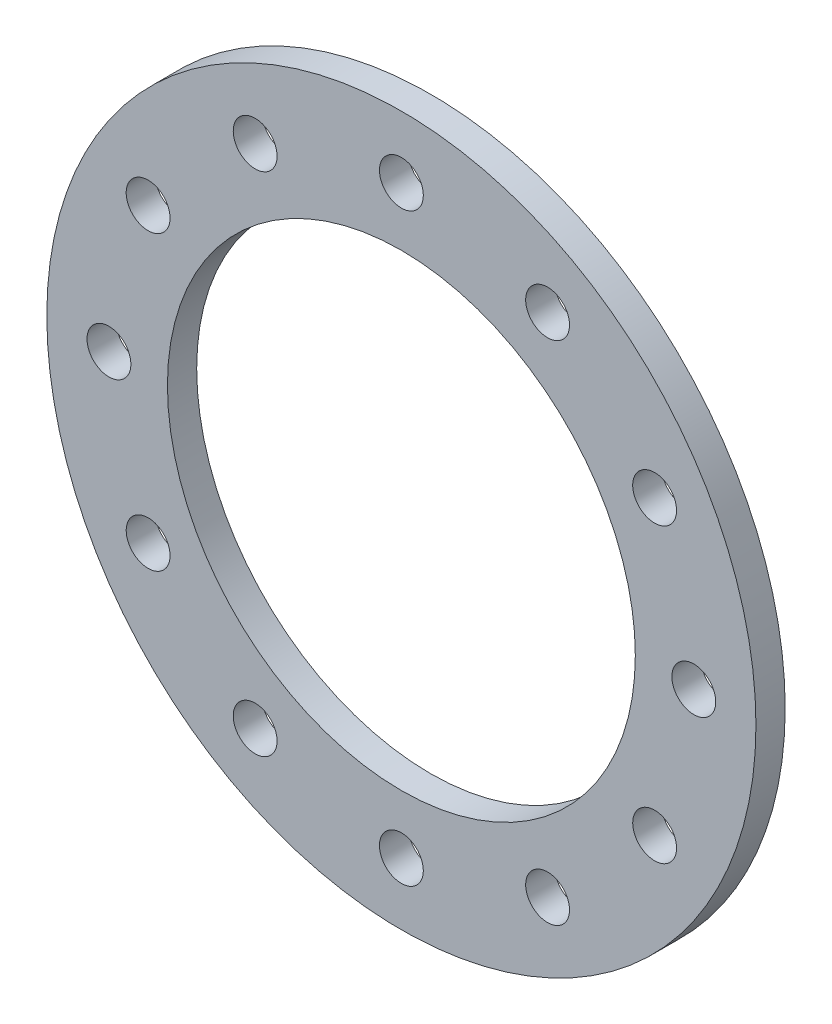
from build123d import *

# Parameters (mm, degrees)
SKETCH_1_R               = 48.5
SKETCH_1_R_2             = 32
EXTRUDE_1_DEPTH          = 4
SKETCH_2_R               = 3
CUT_EXTRUDE_1_DEPTH      = 18.6
PATTERN_CIRCULAR_1_COUNT = 12


with BuildPart() as part:
    # Эскиз1 → Бобышка-Вытянуть1 (new body)
    with BuildSketch(Plane.XY):
        Circle(SKETCH_1_R)
        Circle(SKETCH_1_R_2, mode=Mode.SUBTRACT)
    extrude(amount=EXTRUDE_1_DEPTH)

    # Эскиз2 → Вырез-Вытянуть1 (cut)
    with BuildSketch(Plane(origin=(0, 0, 0), x_dir=(-1, 0, 0), z_dir=(0, 0, -1))):
        with Locations((0, 40)):
            Circle(SKETCH_2_R)
    cut_extrude_1 = extrude(amount=-CUT_EXTRUDE_1_DEPTH, mode=Mode.SUBTRACT)

    # Круговой массив1: Вырез-Вытянуть1 ×12 about axis
    pattern_circular_1_axis = Axis((0, 0, 0), (0, 0, 1))
    for i in range(1, PATTERN_CIRCULAR_1_COUNT):
        add(cut_extrude_1.rotate(pattern_circular_1_axis, i * 360 / PATTERN_CIRCULAR_1_COUNT), mode=Mode.SUBTRACT)


solid = part.part
